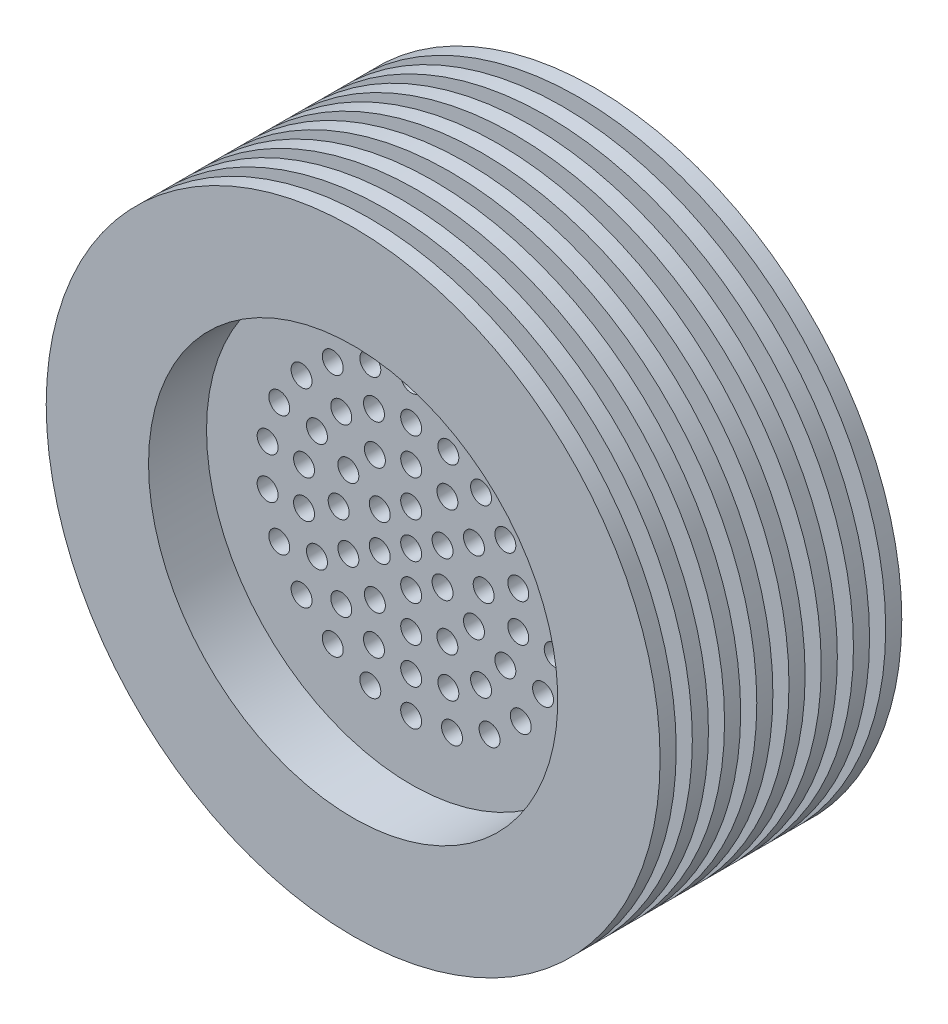
from build123d import *

# Parameters (mm, degrees)
ESQUISSE1_R                = 38.1
BOSS_EXTRU_1_DEPTH         = 32
ESQUISSE2_R                = 25.4
ENL_V_MAT_EXTRU_1_DEPTH    = 12.1
ESQUISSE3_R                = 1.3
ENL_V_MAT_EXTRU_2_DEPTH    = 12.7
ESQUISSE4_R                = 25.4
ENL_V_MAT_EXTRU_3_DEPTH    = 60.314922237
ESQUISSE5_OUTSIDE_W        = 100.682
ESQUISSE5_OUTSIDE_H        = 100.682
ESQUISSE5_OUTSIDE_R        = 34.925
ENL_V_MAT_EXTRU_4_DEPTH    = 2
R_P_TITION_LIN_AIRE1_COUNT = 8
R_P_TITION_LIN_AIRE1_PITCH = 4


with BuildPart() as part:
    # Esquisse1 → Boss.-Extru.1 (new body)
    with BuildSketch(Plane.XY):
        Circle(ESQUISSE1_R)
    extrude(amount=BOSS_EXTRU_1_DEPTH)

    # Esquisse2 → Enlèv. mat.-Extru.1 (cut)
    with BuildSketch(Plane(origin=(0, 0, 0), x_dir=(-1, 0, 0), z_dir=(0, 0, -1))):
        Circle(ESQUISSE2_R)
    extrude(amount=-ENL_V_MAT_EXTRU_1_DEPTH, mode=Mode.SUBTRACT)

    # Esquisse3 → Enlèv. mat.-Extru.2 (cut)
    with BuildSketch(Plane(origin=(0, 0, 12.1), x_dir=(-1, 0, 0), z_dir=(0, 0, -1))):
        Circle(ESQUISSE3_R)
        with Locations((0, 4.5)):
            Circle(ESQUISSE3_R)
        with Locations((0, 9)):
            Circle(ESQUISSE3_R)
        with Locations((0, 13.5)):
            Circle(ESQUISSE3_R)
        with Locations((0, 18)):
            Circle(ESQUISSE3_R)
        with Locations((3.897114317, 2.25)):
            Circle(ESQUISSE3_R)
        with Locations((3.897114317, -2.25)):
            Circle(ESQUISSE3_R)
        with Locations((0, -4.5)):
            Circle(ESQUISSE3_R)
        with Locations((-3.897114317, -2.25)):
            Circle(ESQUISSE3_R)
        with Locations((-3.897114317, 2.25)):
            Circle(ESQUISSE3_R)
        with Locations((4.5, 7.794228634)):
            Circle(ESQUISSE3_R)
        with Locations((7.794228634, 4.5)):
            Circle(ESQUISSE3_R)
        with Locations((9, 0)):
            Circle(ESQUISSE3_R)
        with Locations((7.794228634, -4.5)):
            Circle(ESQUISSE3_R)
        with Locations((4.5, -7.794228634)):
            Circle(ESQUISSE3_R)
        with Locations((0, -9)):
            Circle(ESQUISSE3_R)
        with Locations((-4.5, -7.794228634)):
            Circle(ESQUISSE3_R)
        with Locations((-7.794228634, -4.5)):
            Circle(ESQUISSE3_R)
        with Locations((-9, 0)):
            Circle(ESQUISSE3_R)
        with Locations((-7.794228634, 4.5)):
            Circle(ESQUISSE3_R)
        with Locations((-4.5, 7.794228634)):
            Circle(ESQUISSE3_R)
        with Locations((4.617271935, 12.685850381)):
            Circle(ESQUISSE3_R)
        with Locations((8.677632731, 10.341599982)):
            Circle(ESQUISSE3_R)
        with Locations((11.691342951, 6.75)):
            Circle(ESQUISSE3_R)
        with Locations((13.294904666, 2.344250399)):
            Circle(ESQUISSE3_R)
        with Locations((13.294904666, -2.344250399)):
            Circle(ESQUISSE3_R)
        with Locations((11.691342951, -6.75)):
            Circle(ESQUISSE3_R)
        with Locations((8.677632731, -10.341599982)):
            Circle(ESQUISSE3_R)
        with Locations((4.617271935, -12.685850381)):
            Circle(ESQUISSE3_R)
        with Locations((0, -13.5)):
            Circle(ESQUISSE3_R)
        with Locations((-4.617271935, -12.685850381)):
            Circle(ESQUISSE3_R)
        with Locations((-8.677632731, -10.341599982)):
            Circle(ESQUISSE3_R)
        with Locations((-11.691342951, -6.75)):
            Circle(ESQUISSE3_R)
        with Locations((-13.294904666, -2.344250399)):
            Circle(ESQUISSE3_R)
        with Locations((-13.294904666, 2.344250399)):
            Circle(ESQUISSE3_R)
        with Locations((-11.691342951, 6.75)):
            Circle(ESQUISSE3_R)
        with Locations((-8.677632731, 10.341599982)):
            Circle(ESQUISSE3_R)
        with Locations((-4.617271935, 12.685850381)):
            Circle(ESQUISSE3_R)
        with Locations((5.071186023, 17.270873525)):
            Circle(ESQUISSE3_R)
        with Locations((9.731534714, 15.142563591)):
            Circle(ESQUISSE3_R)
        with Locations((13.603492338, 11.787493211)):
            Circle(ESQUISSE3_R)
        with Locations((16.373375916, 7.477470234)):
            Circle(ESQUISSE3_R)
        with Locations((17.816785954, 2.561667089)):
            Circle(ESQUISSE3_R)
        with Locations((17.816785954, -2.561667089)):
            Circle(ESQUISSE3_R)
        with Locations((16.373375916, -7.477470234)):
            Circle(ESQUISSE3_R)
        with Locations((13.603492338, -11.787493211)):
            Circle(ESQUISSE3_R)
        with Locations((9.731534714, -15.142563591)):
            Circle(ESQUISSE3_R)
        with Locations((5.071186023, -17.270873525)):
            Circle(ESQUISSE3_R)
        with Locations((0, -18)):
            Circle(ESQUISSE3_R)
        with Locations((-5.071186023, -17.270873525)):
            Circle(ESQUISSE3_R)
        with Locations((-9.731534714, -15.142563591)):
            Circle(ESQUISSE3_R)
        with Locations((-13.603492338, -11.787493211)):
            Circle(ESQUISSE3_R)
        with Locations((-16.373375916, -7.477470234)):
            Circle(ESQUISSE3_R)
        with Locations((-17.816785954, -2.561667089)):
            Circle(ESQUISSE3_R)
        with Locations((-17.816785954, 2.561667089)):
            Circle(ESQUISSE3_R)
        with Locations((-16.373375916, 7.477470234)):
            Circle(ESQUISSE3_R)
        with Locations((-13.603492338, 11.787493211)):
            Circle(ESQUISSE3_R)
        with Locations((-9.731534714, 15.142563591)):
            Circle(ESQUISSE3_R)
        with Locations((-5.071186023, 17.270873525)):
            Circle(ESQUISSE3_R)
    extrude(amount=-ENL_V_MAT_EXTRU_2_DEPTH, mode=Mode.SUBTRACT)

    # Esquisse4 → Enlèv. mat.-Extru.3 (cut, through all)
    with BuildSketch(Plane(origin=(0, 0, 24.8), x_dir=(-1, 0, 0), z_dir=(0, 0, -1))):
        Circle(ESQUISSE4_R)
    extrude(amount=-ENL_V_MAT_EXTRU_3_DEPTH, mode=Mode.SUBTRACT)

    # Esquisse5 outside → Enlèv. mat.-Extru.4 (cut)
    with BuildSketch(Plane(origin=(0, 0, 0), x_dir=(-1, 0, 0), z_dir=(0, 0, -1))):
        Rectangle(ESQUISSE5_OUTSIDE_W, ESQUISSE5_OUTSIDE_H)
        Circle(ESQUISSE5_OUTSIDE_R, mode=Mode.SUBTRACT)
    enl_v_mat_extru_4 = extrude(amount=-ENL_V_MAT_EXTRU_4_DEPTH, mode=Mode.SUBTRACT)

    # Répétition linéaire1: Enlèv. mat.-Extru.4 ×8
    with Locations(*[(0, 0, i * R_P_TITION_LIN_AIRE1_PITCH) for i in range(1, R_P_TITION_LIN_AIRE1_COUNT)]):
        add(enl_v_mat_extru_4, mode=Mode.SUBTRACT)


solid = part.part
